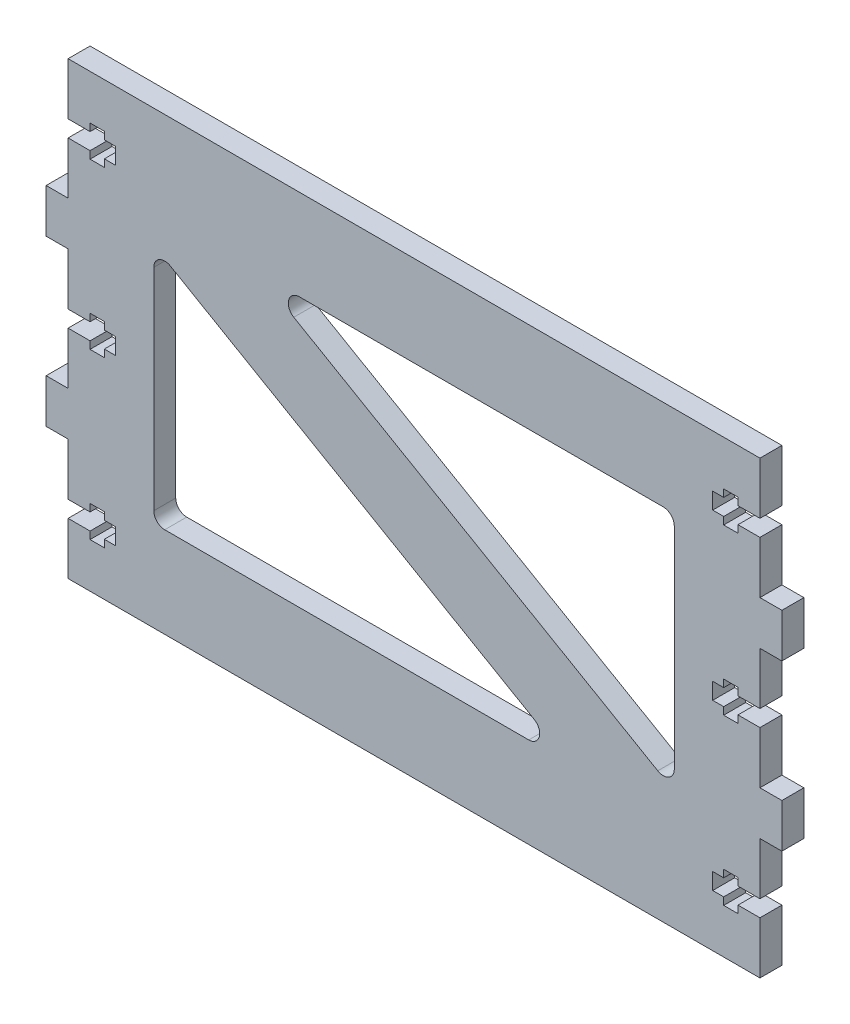
from build123d import *

# Parameters (mm, degrees)
EXTRUDE_1_DEPTH     = 4
CUT_EXTRUDE_1_DEPTH = 10


with BuildPart() as part:
    # 草图1 → 凸台-拉伸1 (new body)
    with BuildSketch(Plane.XY):
        Polygon((55.534285714, 24.23), (59.534285714, 24.23), (59.534285714, 16.23), (55.534285714, 16.23), (55.534285714, 6.73), (51.534285714, 6.73), (51.534285714, 8.08), (48.934285714, 8.08), (48.934285714, 6.73), (46.934285714, 6.73), (46.934285714, 3.73), (48.934285714, 3.73), (48.934285714, 2.38), (51.534285714, 2.38), (51.534285714, 3.73), (55.534285714, 3.73), (55.534285714, -5.77), (59.534285714, -5.77), (59.534285714, -13.77), (55.534285714, -13.77), (55.534285714, -23.27), (51.534285714, -23.27), (51.534285714, -21.92), (48.934285714, -21.92), (48.934285714, -23.27), (46.934285714, -23.27), (46.934285714, -26.27), (48.934285714, -26.27), (48.934285714, -27.62), (51.534285714, -27.62), (51.534285714, -26.27), (55.534285714, -26.27), (55.534285714, -35.77), (-70.465714286, -35.77), (-70.465714286, -26.27), (-66.465714286, -26.27), (-66.465714286, -27.62), (-63.865714286, -27.62), (-63.865714286, -26.27), (-61.865714286, -26.27), (-61.865714286, -23.27), (-63.865714286, -23.27), (-63.865714286, -21.92), (-66.465714286, -21.92), (-66.465714286, -23.27), (-70.465714286, -23.27), (-70.465714286, -13.77), (-74.465714286, -13.77), (-74.465714286, -5.77), (-70.465714286, -5.77), (-70.465714286, 3.73), (-66.465714286, 3.73), (-66.465714286, 2.38), (-63.865714286, 2.38), (-63.865714286, 3.73), (-61.865714286, 3.73), (-61.865714286, 6.73), (-63.865714286, 6.73), (-63.865714286, 8.08), (-66.465714286, 8.08), (-66.465714286, 6.73), (-70.465714286, 6.73), (-70.465714286, 16.23), (-74.465714286, 16.23), (-74.465714286, 24.23), (-70.465714286, 24.23), (-70.465714286, 33.73), (-66.465714286, 33.73), (-66.465714286, 32.38), (-63.865714286, 32.38), (-63.865714286, 33.73), (-61.865714286, 33.73), (-61.865714286, 36.73), (-63.865714286, 36.73), (-63.865714286, 38.08), (-66.465714286, 38.08), (-66.465714286, 36.73), (-70.465714286, 36.73), (-70.465714286, 46.23), (55.534285714, 46.23), (55.534285714, 36.73), (51.534285714, 36.73), (51.534285714, 38.08), (48.934285714, 38.08), (48.934285714, 36.73), (46.934285714, 36.73), (46.934285714, 33.73), (48.934285714, 33.73), (48.934285714, 32.38), (51.534285714, 32.38), (51.534285714, 33.73), (55.534285714, 33.73), align=None)
    extrude(amount=EXTRUDE_1_DEPTH)

    # 草图3 → 切除-拉伸1 (cut)
    with BuildSketch(Plane.XY.offset(4)):
        with BuildLine():
            Line((14.43310292, -15.539220042), (-51.863516332, 22.849447356))
            ThreePointArc((-51.863516332, 22.849447356), (-53.864614704, 22.851352584), (-54.865714286, 21.118667398))
            Line((-54.865714286, 21.118667398), (-54.865714286, -17.27))
            ThreePointArc((-54.865714286, -17.27), (-54.279927848, -18.684213562), (-52.865714286, -19.27))
            Line((-52.865714286, -19.27), (13.430904966, -19.27))
            ThreePointArc((13.430904966, -19.27), (15.362427671, -17.788864185), (14.43310292, -15.539220042))
        make_face()
        with BuildLine():
            Line((-28.362333538, 29.73), (37.934285714, 29.73))
            ThreePointArc((37.934285714, 29.73), (39.348499277, 29.144213562), (39.934285714, 27.73))
            Line((39.934285714, 27.73), (39.934285714, -10.658667398))
            ThreePointArc((39.934285714, -10.658667398), (38.933186133, -12.391352584), (36.932087761, -12.389447356))
            Line((36.932087761, -12.389447356), (-29.364531491, 25.999220042))
            ThreePointArc((-29.364531491, 25.999220042), (-30.293856242, 28.248864185), (-28.362333538, 29.73))
        make_face()
    extrude(amount=-CUT_EXTRUDE_1_DEPTH, mode=Mode.SUBTRACT)


solid = part.part
